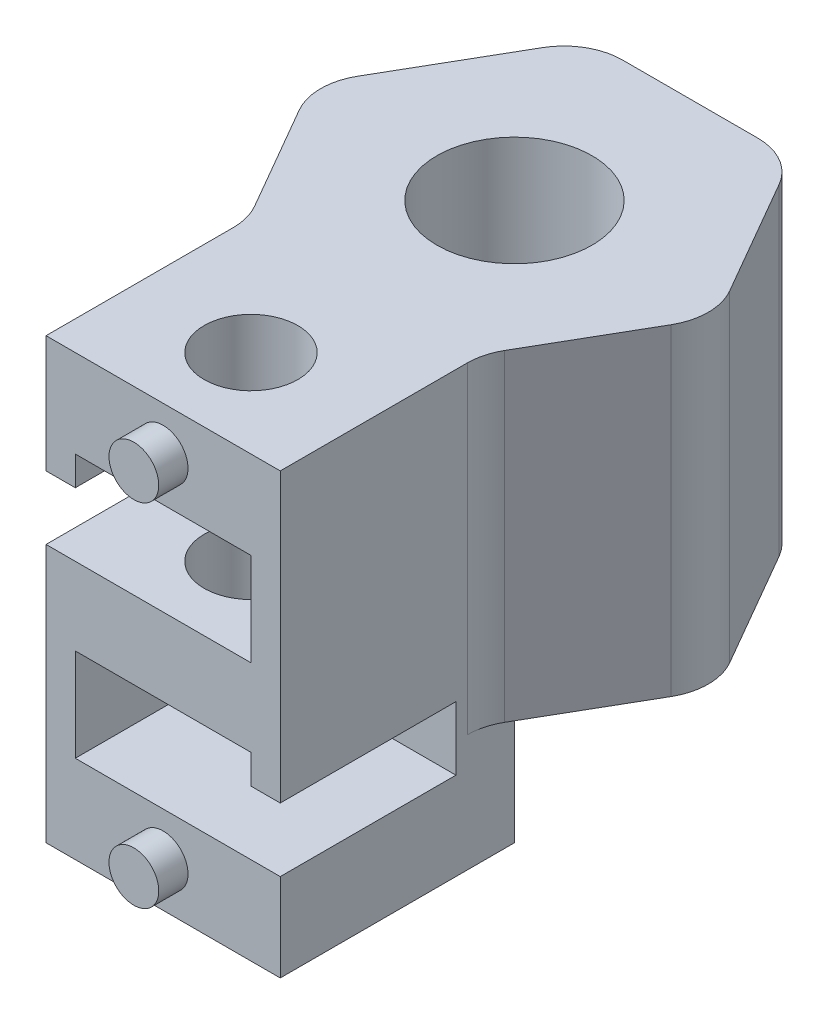
from build123d import *

# Parameters (mm, degrees)
SKETCH1_W                = 8
SKETCH1_H                = 15
BOSS_EXTRUDE1_DEPTH      = 4
CUT_EXTRUDE1_DEPTH       = 6
M3_CLEARANCE_HOLE2_D     = 3.2
M3_CLEARANCE_HOLE2_DEPTH = 12
SKETCH9_R                = 0.85
BOSS_EXTRUDE2_DEPTH      = 1
SKETCH12_W               = 8
SKETCH12_H               = 6
BOSS_EXTRUDE3_DEPTH      = 8
M5_CLEARANCE_HOLE1_D     = 5.3
BOSS_EXTRUDE4_START      = -6
SKETCH18_R               = 2.65
BOSS_EXTRUDE4_DEPTH      = 6
BOSS_EXTRUDE5_DEPTH      = 11
FILLET2_R                = 2


with BuildPart() as part:
    # Sketch1 → Boss-Extrude1 (new, symmetric)
    with BuildSketch(Plane.XY):
        Rectangle(SKETCH1_W, SKETCH1_H)
    extrude(amount=BOSS_EXTRUDE1_DEPTH, both=True)

    # Sketch2 → Cut-Extrude1 (cut)
    with BuildSketch(Plane.XY.offset(4)):
        Polygon((-3, 4.5), (3, 4.5), (3, 1.325), (-4, 1.325), (-4, 3.5), (-3, 3.5), align=None)
        Polygon((4, -4.5), (-3, -4.5), (-3, -1.325), (3, -1.325), (3, -2.325), (4, -2.325), align=None)
    extrude(amount=-CUT_EXTRUDE1_DEPTH, mode=Mode.SUBTRACT)

    # M3 Clearance Hole2
    with Locations(Plane(origin=(0, 7.5, 0), x_dir=(1, 0, 0), z_dir=(0, 1, 0))):
        with Locations((0, -1)):
            Hole(M3_CLEARANCE_HOLE2_D / 2, depth=M3_CLEARANCE_HOLE2_DEPTH)

    # Sketch9 → Boss-Extrude2 (add)
    with BuildSketch(Plane.XY.offset(4)):
        with Locations(Location((0, 6, 0), (0, 0, 180))):
            Circle(SKETCH9_R)
        with Locations(Location((0, -6, 0), (0, 0, 180))):
            Circle(SKETCH9_R)
    extrude(amount=BOSS_EXTRUDE2_DEPTH)

    # Sketch12 → Boss-Extrude3 (add)
    with BuildSketch(Plane(origin=(0, 0, -4), x_dir=(-1, 0, 0), z_dir=(0, 0, -1))):
        with Locations((0, 4.5)):
            Rectangle(SKETCH12_W, SKETCH12_H)
    extrude(amount=BOSS_EXTRUDE3_DEPTH)

    # M5 Clearance Hole1 (through all)
    with Locations(Plane(origin=(0, 7.5, 0), x_dir=(1, 0, 0), z_dir=(0, 1, 0))):
        with Locations((0, 8)):
            Hole(M5_CLEARANCE_HOLE1_D / 2)

    # Sketch18 → Boss-Extrude4 (add)
    with BuildSketch(Plane(origin=(0, 7.5, 0), x_dir=(1, 0, 0), z_dir=(0, 1, 0)).offset(BOSS_EXTRUDE4_START)):
        Polygon((4.618802154, 8), (2.309401077, 12), (-2.309401077, 12), (-4.618802154, 8), (-2.309401077, 4), (2.309401077, 4), align=None)
        with Locations(Location((0, 8, 0), (0, 0, 270))):
            Circle(SKETCH18_R, mode=Mode.SUBTRACT)
    extrude(amount=BOSS_EXTRUDE4_DEPTH)

    # Sketch19 → Boss-Extrude5 (add)
    with BuildSketch(Plane(origin=(0, 7.5, 0), x_dir=(1, 0, 0), z_dir=(0, 1, 0))):
        Polygon((4, 2.92820323), (6.92820323, 8), (3.464101615, 14), (-3.464101615, 14), (-6.92820323, 8), (-4, 2.92820323), (-4, 6.92820323), (-4.618802154, 8), (-4, 9.07179677), (-4, 12), (-2.309401077, 12), (2.309401077, 12), (4, 12), (4, 9.07179677), (4.618802154, 8), (4, 6.92820323), align=None)
        Polygon((2.309401077, 12), (4, 9.07179677), (4, 12), align=None)
        Polygon((-4, 9.07179677), (-2.309401077, 12), (-4, 12), align=None)
        Polygon((3.464101615, 2), (4, 2.92820323), (4, 6.92820323), (2.309401077, 4), (-2.309401077, 4), (-4, 6.92820323), (-4, 2.92820323), (-3.464101615, 2), align=None)
    extrude(amount=-BOSS_EXTRUDE5_DEPTH)

    # Fillet2
    fillet2_edges = [part.edges().sort_by_distance(p)[0] for p in [
        (6.92820323, 2, -8),
        (-4, 2, -2.92820323),
        (-6.92820323, 2, -8),
        (-3.464101615, 2, -14),
        (3.464101615, 2, -14),
        (4, 2, -2.92820323),
    ]]
    fillet(fillet2_edges, radius=FILLET2_R)


solid = part.part
